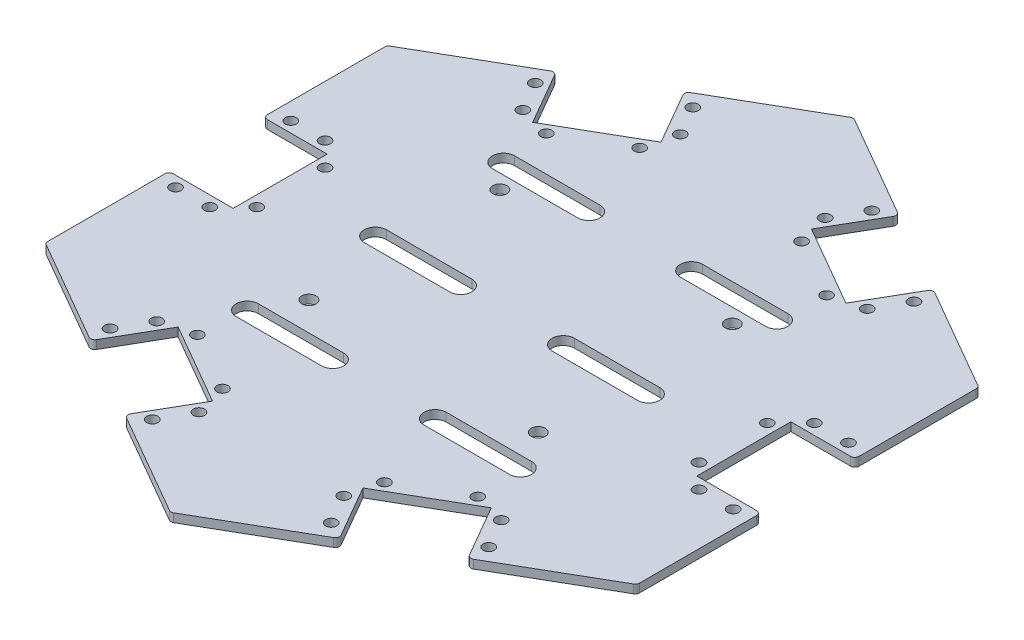
from build123d import *

# Parameters (mm, degrees)
SKETCH1_R           = 1.3
BOSS_EXTRUDE1_DEPTH = 2
SKETCH2_W           = 15
SKETCH2_H           = 22
CUT_EXTRUDE1_DEPTH  = 2
FILLET1_R           = 1
CUT_EXTRUDE2_DEPTH  = 2
SKETCH5_R           = 1.65
CUT_EXTRUDE3_DEPTH  = 2


with BuildPart() as part:
    # Sketch1 → Boss-Extrude1 (new body)
    with BuildSketch(Plane(origin=(0, 0, 0), x_dir=(1, 0, 0), z_dir=(0, 1, 0))):
        Polygon((0, -80), (69.282032303, -40), (69.282032303, 40), (0, 80), (-69.282032303, 40), (-69.282032303, -40), align=None)
        with Locations(Location((65.282032303, 13.5, 0), (0, 0, 270))):
            Circle(SKETCH1_R, mode=Mode.SUBTRACT)
        with Locations(Location((57.282032303, 13.5, 0), (0, 0, 270))):
            Circle(SKETCH1_R, mode=Mode.SUBTRACT)
        with Locations(Location((51.782032303, 8, 0), (0, 0, 270))):
            Circle(SKETCH1_R, mode=Mode.SUBTRACT)
        with Locations(Location((51.782032303, -8, 0), (0, 0, 270))):
            Circle(SKETCH1_R, mode=Mode.SUBTRACT)
        with Locations(Location((57.282032303, -13.5, 0), (0, 0, 270))):
            Circle(SKETCH1_R, mode=Mode.SUBTRACT)
        with Locations(Location((65.282032303, -13.5, 0), (0, 0, 270))):
            Circle(SKETCH1_R, mode=Mode.SUBTRACT)
        with Locations(Location((32.819219382, -40.844555434, 0), (0, 0, 270))):
            Circle(SKETCH1_R, mode=Mode.SUBTRACT)
        with Locations(Location((20.9496732, -63.285898385, 0), (0, 0, 270))):
            Circle(SKETCH1_R, mode=Mode.SUBTRACT)
        with Locations(Location((16.9496732, -56.357695155, 0), (0, 0, 270))):
            Circle(SKETCH1_R, mode=Mode.SUBTRACT)
        with Locations(Location((18.962812921, -48.844555434, 0), (0, 0, 270))):
            Circle(SKETCH1_R, mode=Mode.SUBTRACT)
        with Locations(Location((44.332359102, -49.785898385, 0), (0, 0, 270))):
            Circle(SKETCH1_R, mode=Mode.SUBTRACT)
        with Locations(Location((40.332359102, -42.857695155, 0), (0, 0, 270))):
            Circle(SKETCH1_R, mode=Mode.SUBTRACT)
        with Locations(Location((-44.332359102, -49.785898385, 0), (0, 0, 270))):
            Circle(SKETCH1_R, mode=Mode.SUBTRACT)
        with Locations(Location((-40.332359102, -42.857695155, 0), (0, 0, 270))):
            Circle(SKETCH1_R, mode=Mode.SUBTRACT)
        with Locations(Location((-32.819219382, -40.844555434, 0), (0, 0, 270))):
            Circle(SKETCH1_R, mode=Mode.SUBTRACT)
        with Locations(Location((-18.962812921, -48.844555434, 0), (0, 0, 270))):
            Circle(SKETCH1_R, mode=Mode.SUBTRACT)
        with Locations(Location((-16.9496732, -56.357695155, 0), (0, 0, 270))):
            Circle(SKETCH1_R, mode=Mode.SUBTRACT)
        with Locations(Location((-20.9496732, -63.285898385, 0), (0, 0, 270))):
            Circle(SKETCH1_R, mode=Mode.SUBTRACT)
        with Locations(Location((18.962812921, 48.844555434, 0), (0, 0, 270))):
            Circle(SKETCH1_R, mode=Mode.SUBTRACT)
        with Locations(Location((44.332359102, 49.785898385, 0), (0, 0, 270))):
            Circle(SKETCH1_R, mode=Mode.SUBTRACT)
        with Locations(Location((40.332359102, 42.857695155, 0), (0, 0, 270))):
            Circle(SKETCH1_R, mode=Mode.SUBTRACT)
        with Locations(Location((32.819219382, 40.844555434, 0), (0, 0, 270))):
            Circle(SKETCH1_R, mode=Mode.SUBTRACT)
        with Locations(Location((20.9496732, 63.285898385, 0), (0, 0, 270))):
            Circle(SKETCH1_R, mode=Mode.SUBTRACT)
        with Locations(Location((16.9496732, 56.357695155, 0), (0, 0, 270))):
            Circle(SKETCH1_R, mode=Mode.SUBTRACT)
        with Locations(Location((-65.282032303, 13.5, 0), (0, 0, 270))):
            Circle(SKETCH1_R, mode=Mode.SUBTRACT)
        with Locations(Location((-20.9496732, 63.285898385, 0), (0, 0, 270))):
            Circle(SKETCH1_R, mode=Mode.SUBTRACT)
        with Locations(Location((-16.9496732, 56.357695155, 0), (0, 0, 270))):
            Circle(SKETCH1_R, mode=Mode.SUBTRACT)
        with Locations(Location((-18.962812921, 48.844555434, 0), (0, 0, 270))):
            Circle(SKETCH1_R, mode=Mode.SUBTRACT)
        with Locations(Location((-32.819219382, 40.844555434, 0), (0, 0, 270))):
            Circle(SKETCH1_R, mode=Mode.SUBTRACT)
        with Locations(Location((-44.332359102, 49.785898385, 0), (0, 0, 270))):
            Circle(SKETCH1_R, mode=Mode.SUBTRACT)
        with Locations(Location((-40.332359102, 42.857695155, 0), (0, 0, 270))):
            Circle(SKETCH1_R, mode=Mode.SUBTRACT)
        with Locations(Location((-57.282032303, 13.5, 0), (0, 0, 270))):
            Circle(SKETCH1_R, mode=Mode.SUBTRACT)
        with Locations(Location((-51.782032303, 8, 0), (0, 0, 270))):
            Circle(SKETCH1_R, mode=Mode.SUBTRACT)
        with Locations(Location((-51.782032303, -8, 0), (0, 0, 270))):
            Circle(SKETCH1_R, mode=Mode.SUBTRACT)
        with Locations(Location((-57.282032303, -13.5, 0), (0, 0, 270))):
            Circle(SKETCH1_R, mode=Mode.SUBTRACT)
        with Locations(Location((-65.282032303, -13.5, 0), (0, 0, 270))):
            Circle(SKETCH1_R, mode=Mode.SUBTRACT)
    extrude(amount=BOSS_EXTRUDE1_DEPTH)

    # Sketch2 → Cut-Extrude1 (cut)
    with BuildSketch(Plane(origin=(0, 2, 0), x_dir=(1, 0, 0), z_dir=(0, 1, 0))):
        with Locations((61.782032303, 0)):
            Rectangle(SKETCH2_W, SKETCH2_H)
        Polygon((44.167295593, -54.5), (36.667295593, -41.509618943), (17.61473671, -52.509618943), (25.11473671, -65.5), align=None)
        Polygon((-25.11473671, -65.5), (-44.167295593, -54.5), (-36.667295593, -41.509618943), (-17.61473671, -52.509618943), align=None)
        Polygon((25.11473671, 65.5), (17.61473671, 52.509618943), (36.667295593, 41.509618943), (44.167295593, 54.5), align=None)
        Polygon((-44.167295593, 54.5), (-25.11473671, 65.5), (-17.61473671, 52.509618943), (-36.667295593, 41.509618943), align=None)
        with Locations((-61.782032303, 0)):
            Rectangle(SKETCH2_W, SKETCH2_H)
    extrude(amount=-CUT_EXTRUDE1_DEPTH, mode=Mode.SUBTRACT)

    # Fillet1
    fillet1_edges = [part.edges().sort_by_distance(p)[0] for p in [
        (69.282032303, 1, -11),
        (69.282032303, 1, 11),
        (44.167295593, 1, 54.5),
        (25.11473671, 1, 65.5),
        (-25.11473671, 1, 65.5),
        (-44.167295593, 1, 54.5),
        (25.11473671, 1, -65.5),
        (44.167295593, 1, -54.5),
        (-44.167295593, 1, -54.5),
        (-25.11473671, 1, -65.5),
        (-69.282032303, 1, 11),
        (-69.282032303, 1, -11),
        (-69.282032303, 1, -40),
        (0, 1, -80),
        (69.282032303, 1, -40),
        (69.282032303, 1, 40),
        (0, 1, 80),
        (-69.282032303, 1, 40),
    ]]
    fillet(fillet1_edges, radius=FILLET1_R)

    # Sketch3 → Cut-Extrude2 (cut)
    with BuildSketch(Plane(origin=(0, 2, 0), x_dir=(1, 0, 0), z_dir=(0, 1, 0))):
        with BuildLine():
            Line((-32, 32.6), (-12, 32.6))
            ThreePointArc((-12, 32.6), (-9.4, 30), (-12, 27.4))
            Line((-12, 27.4), (-32, 27.4))
            ThreePointArc((-32, 27.4), (-34.6, 30), (-32, 32.6))
        make_face()
        with BuildLine():
            Line((-32, 2.6), (-12, 2.6))
            ThreePointArc((-12, 2.6), (-9.4, 0), (-12, -2.6))
            Line((-12, -2.6), (-32, -2.6))
            ThreePointArc((-32, -2.6), (-34.6, 0), (-32, 2.6))
        make_face()
        with BuildLine():
            Line((-32, -27.4), (-12, -27.4))
            ThreePointArc((-12, -27.4), (-9.4, -30), (-12, -32.6))
            Line((-12, -32.6), (-32, -32.6))
            ThreePointArc((-32, -32.6), (-34.6, -30), (-32, -27.4))
        make_face()
        with BuildLine():
            Line((32, -32.6), (12, -32.6))
            ThreePointArc((12, -32.6), (9.4, -30), (12, -27.4))
            Line((12, -27.4), (32, -27.4))
            ThreePointArc((32, -27.4), (34.6, -30), (32, -32.6))
        make_face()
        with BuildLine():
            Line((32, 27.4), (12, 27.4))
            ThreePointArc((12, 27.4), (9.4, 30), (12, 32.6))
            Line((12, 32.6), (32, 32.6))
            ThreePointArc((32, 32.6), (34.6, 30), (32, 27.4))
        make_face()
        with BuildLine():
            Line((32, -2.6), (12, -2.6))
            ThreePointArc((12, -2.6), (9.4, 0), (12, 2.6))
            Line((12, 2.6), (32, 2.6))
            ThreePointArc((32, 2.6), (34.6, 0), (32, -2.6))
        make_face()
    extrude(amount=-CUT_EXTRUDE2_DEPTH, mode=Mode.SUBTRACT)

    # Sketch5 → Cut-Extrude3 (cut)
    with BuildSketch(Plane(origin=(0, 2, 0), x_dir=(1, 0, 0), z_dir=(0, 1, 0))):
        with Locations(Location((-26.85, 24, 0), (0, 0, 270))):
            Circle(SKETCH5_R)
        with Locations(Location((27.584263601, 24, 0), (0, 0, 270))):
            Circle(SKETCH5_R)
        with Locations(Location((26.85, -20.7, 0), (0, 0, 270))):
            Circle(SKETCH5_R)
        with Locations(Location((-26.85, -20.7, 0), (0, 0, 270))):
            Circle(SKETCH5_R)
    extrude(amount=-CUT_EXTRUDE3_DEPTH, mode=Mode.SUBTRACT)


solid = part.part
